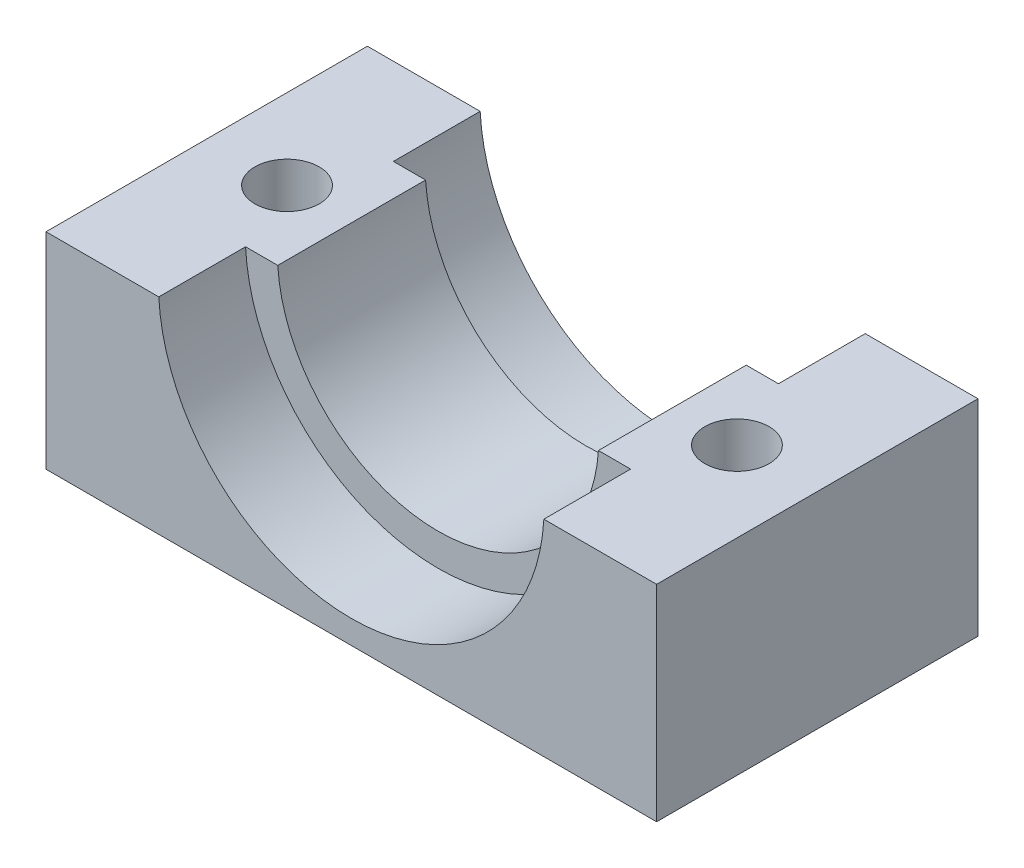
from build123d import *

# Parameters (mm, degrees)
SKETCH1_W           = 50
SKETCH1_H           = 32
BOSS_EXTRUDE1_DEPTH = 47.5
SKETCH4_R           = 5
CUT_EXTRUDE1_DEPTH  = 75


with BuildPart() as part:
    # Sketch1 → Boss-Extrude1 (new, symmetric)
    with BuildSketch(Plane(origin=(0, 0, 0), x_dir=(0, 0, -1), z_dir=(1, 0, 0))):
        Rectangle(SKETCH1_W, SKETCH1_H)
    extrude(amount=BOSS_EXTRUDE1_DEPTH, both=True)

    # Sketch3 → Cut-Revolve1 (revolve, cut)
    with BuildSketch(Plane(origin=(0, 0, 0), x_dir=(0, 0, -1), z_dir=(1, 0, 0))):
        Polygon((-25, -12.35), (-11.5, -12.35), (-11.5, -7.35), (11.5, -7.35), (11.5, -12.35), (25, -12.35), (25, 16.59588936), (-25, 16.59588936), align=None)
    revolve(axis=Axis((0, 17.65, -20.249126458), (0, 0, -1)), mode=Mode.SUBTRACT)

    # Sketch4 → Cut-Extrude1 (cut)
    with BuildSketch(Plane(origin=(0, 16, 0), x_dir=(1, 0, 0), z_dir=(0, 1, 0))):
        with Locations(Location((-35, 0, 0), (0, 0, 270))):
            Circle(SKETCH4_R)
        with Locations(Location((35, 0, 0), (0, 0, 270))):
            Circle(SKETCH4_R)
    extrude(amount=-CUT_EXTRUDE1_DEPTH, mode=Mode.SUBTRACT)


solid = part.part
